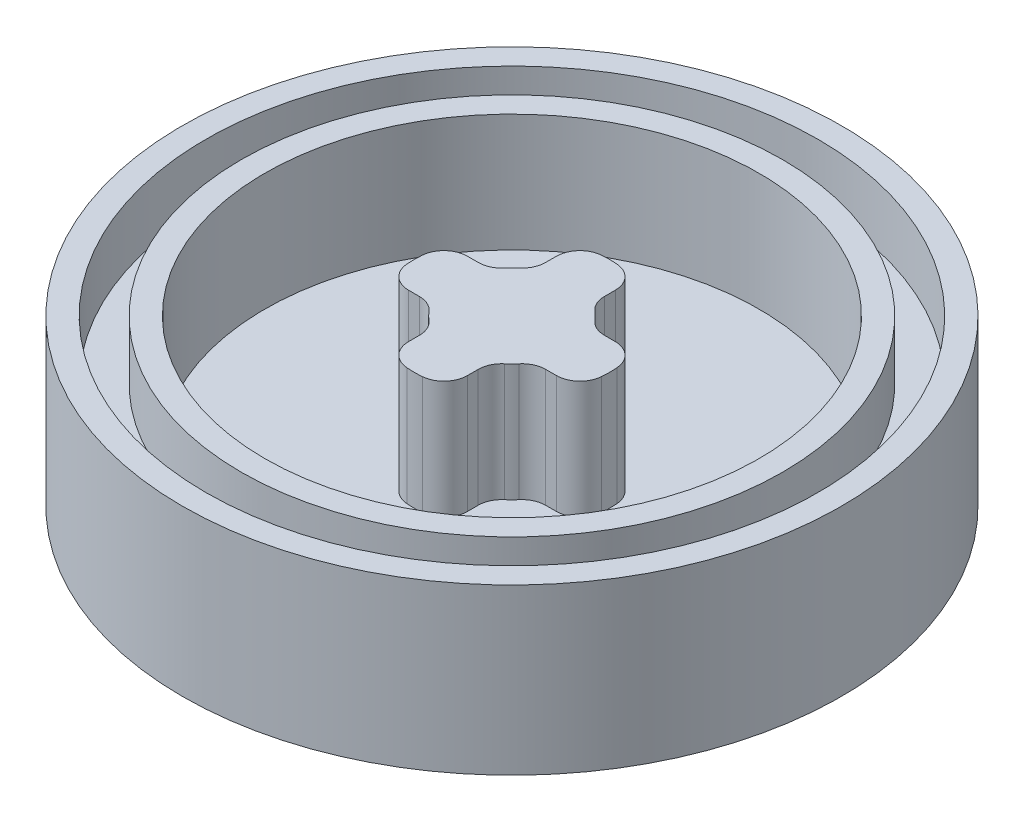
from build123d import *

# Parameters (mm, degrees)
BOSS_EXTRUDE1_DEPTH = 10


with BuildPart() as part:
    # Sketch1 → Revolve1 (revolve)
    with BuildSketch(Plane.XY, mode=Mode.PRIVATE) as revolve1_sk:
        Polygon((0, 0), (-28, 0), (-28, 14), (-26, 14), (-26, 9), (-23, 9), (-23, 14), (-21, 14), (-21, 4), (0, 4), align=None)
    revolve(revolve1_sk.sketch.rotate(Axis((0, 4, 0), (0, -1, 0)), 270), axis=Axis((0, 4, 0), (0, -1, 0)))

    # Sketch3 → Boss-Extrude1 (add)
    with BuildSketch(Plane(origin=(0, 4, 0), x_dir=(1, 0, 0), z_dir=(0, 1, 0))):
        with BuildLine():
            ThreePointArc((-3.829930462, -3.214285714), (-4.516748393, -2.687346066), (-5.361902647, -2.5))
            Line((-5.361902647, -2.5), (-6.280127387, -2.5))
            ThreePointArc((-6.280127387, -2.5), (-7.637061373, -1.969261773), (-8.273818621, -0.658730159))
            ThreePointArc((-8.273818621, -0.658730159), (-8.3, 0), (-8.273818621, 0.658730159))
            ThreePointArc((-8.273818621, 0.658730159), (-7.637061373, 1.969261773), (-6.280127387, 2.5))
            Line((-6.280127387, 2.5), (-5.361902647, 2.5))
            ThreePointArc((-5.361902647, 2.5), (-4.516748393, 2.687346066), (-3.829930462, 3.214285714))
            ThreePointArc((-3.829930462, 3.214285714), (-3.686233368, 3.378118346), (-3.535533906, 3.535533906))
            ThreePointArc((-3.535533906, 3.535533906), (-3.378118346, 3.686233368), (-3.214285714, 3.829930462))
            ThreePointArc((-3.214285714, 3.829930462), (-2.687346066, 4.516748393), (-2.5, 5.361902647))
            Line((-2.5, 5.361902647), (-2.5, 6.280127387))
            ThreePointArc((-2.5, 6.280127387), (-1.969261773, 7.637061373), (-0.658730159, 8.273818621))
            ThreePointArc((-0.658730159, 8.273818621), (0, 8.3), (0.658730159, 8.273818621))
            ThreePointArc((0.658730159, 8.273818621), (1.969261773, 7.637061373), (2.5, 6.280127387))
            Line((2.5, 6.280127387), (2.5, 5.361902647))
            ThreePointArc((2.5, 5.361902647), (2.687346066, 4.516748393), (3.214285714, 3.829930462))
            ThreePointArc((3.214285714, 3.829930462), (3.378118346, 3.686233368), (3.535533906, 3.535533906))
            ThreePointArc((3.535533906, 3.535533906), (3.686233368, 3.378118346), (3.829930462, 3.214285714))
            ThreePointArc((3.829930462, 3.214285714), (4.516748393, 2.687346066), (5.361902647, 2.5))
            Line((5.361902647, 2.5), (6.280127387, 2.5))
            ThreePointArc((6.280127387, 2.5), (7.637061373, 1.969261773), (8.273818621, 0.658730159))
            ThreePointArc((8.273818621, 0.658730159), (8.3, 0), (8.273818621, -0.658730159))
            ThreePointArc((8.273818621, -0.658730159), (7.637061373, -1.969261773), (6.280127387, -2.5))
            Line((6.280127387, -2.5), (5.361902647, -2.5))
            ThreePointArc((5.361902647, -2.5), (4.516748393, -2.687346066), (3.829930462, -3.214285714))
            ThreePointArc((3.829930462, -3.214285714), (3.686233368, -3.378118346), (3.535533906, -3.535533906))
            ThreePointArc((3.535533906, -3.535533906), (3.378118346, -3.686233368), (3.214285714, -3.829930462))
            ThreePointArc((3.214285714, -3.829930462), (2.687346066, -4.516748393), (2.5, -5.361902647))
            Line((2.5, -5.361902647), (2.5, -6.280127387))
            ThreePointArc((2.5, -6.280127387), (1.969261773, -7.637061373), (0.658730159, -8.273818621))
            ThreePointArc((0.658730159, -8.273818621), (0, -8.3), (-0.658730159, -8.273818621))
            ThreePointArc((-0.658730159, -8.273818621), (-1.969261773, -7.637061373), (-2.5, -6.280127387))
            Line((-2.5, -6.280127387), (-2.5, -5.361902647))
            ThreePointArc((-2.5, -5.361902647), (-2.687346066, -4.516748393), (-3.214285714, -3.829930462))
            ThreePointArc((-3.214285714, -3.829930462), (-3.378118346, -3.686233368), (-3.535533906, -3.535533906))
            ThreePointArc((-3.535533906, -3.535533906), (-3.686233368, -3.378118346), (-3.829930462, -3.214285714))
        make_face()
    extrude(amount=BOSS_EXTRUDE1_DEPTH)


solid = part.part
